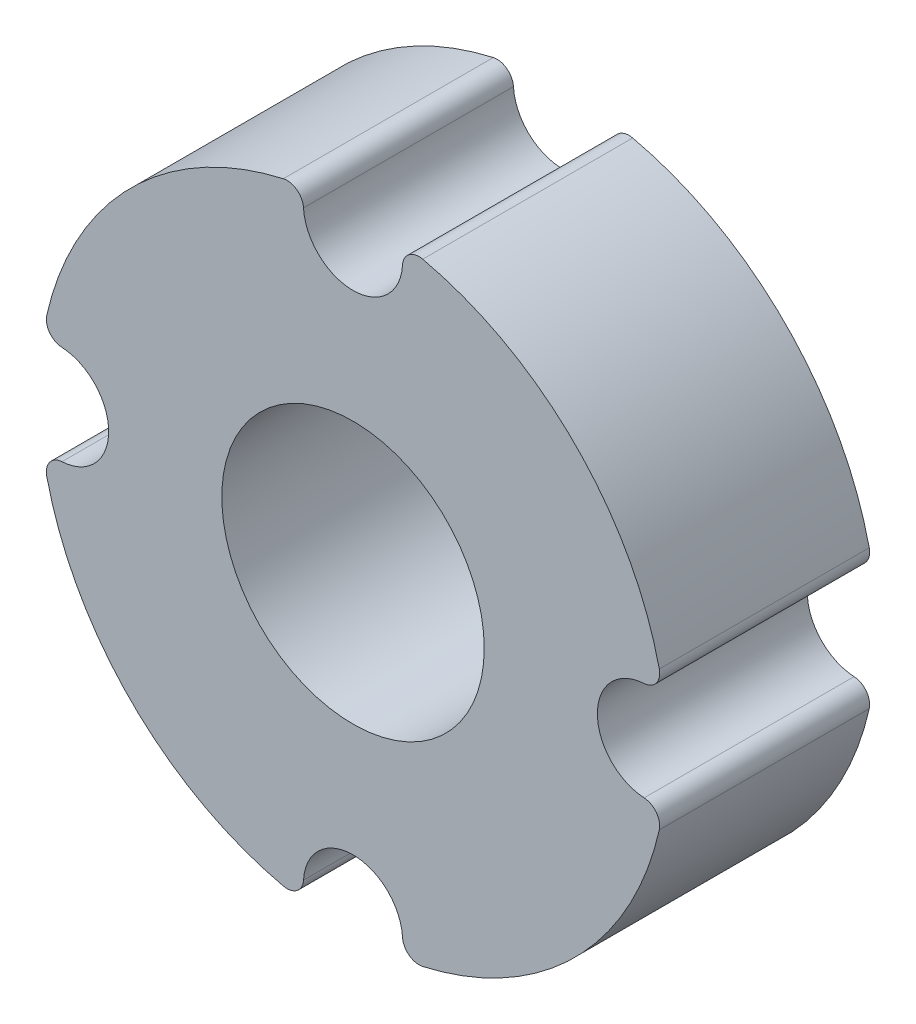
from build123d import *

# Parameters (mm, degrees)
SKETCH1_R             = 9.5
SKETCH1_R_2           = 3.96875
BOSS_EXTRUDE1_DEPTH   = 6.35
F_3_0MM_DOWEL_HOLE1_D = 3
CIRPATTERN1_COUNT     = 4
FILLET1_R             = 0.5


with BuildPart() as part:
    # Sketch1 → Boss-Extrude1 (new body)
    with BuildSketch(Plane.XY):
        Circle(SKETCH1_R)
        Circle(SKETCH1_R_2, mode=Mode.SUBTRACT)
    extrude(amount=BOSS_EXTRUDE1_DEPTH)

    # Ø3.0mm Dowel Hole1 (through all)
    with Locations(Plane.XY.offset(6.35)):
        with Locations((0, 8.89)):
            f_3_0mm_dowel_hole1 = Hole(F_3_0MM_DOWEL_HOLE1_D / 2)

    # CirPattern1: Ø3.0mm Dowel Hole1 ×4 about axis
    cirpattern1_axis = Axis((0, 0, 0), (0, 0, 1))
    for i in range(1, CIRPATTERN1_COUNT):
        add(f_3_0mm_dowel_hole1.rotate(cirpattern1_axis, i * 360 / CIRPATTERN1_COUNT), mode=Mode.SUBTRACT)

    # Fillet1
    fillet1_edges = [part.edges().sort_by_distance(p)[0] for p in [
        (-1.412656886, 9.394381327, 3.175),
        (1.412656886, 9.394381327, 3.175),
        (-9.394381327, -1.412656886, 3.175),
        (-9.394381327, 1.412656886, 3.175),
        (1.412656886, -9.394381327, 3.175),
        (-1.412656886, -9.394381327, 3.175),
        (9.394381327, 1.412656886, 3.175),
        (9.394381327, -1.412656886, 3.175),
    ]]
    fillet(fillet1_edges, radius=FILLET1_R)


solid = part.part
